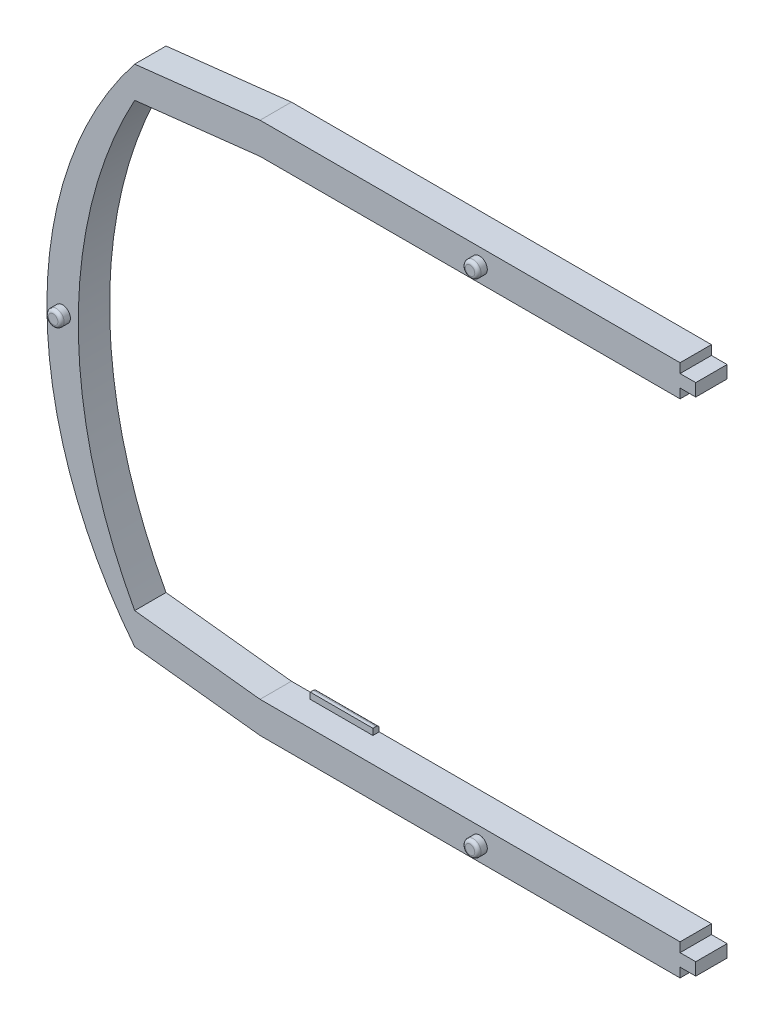
from build123d import *

# Parameters (mm, degrees)
ESQUISSE1_R        = 2.5
BOSS_EXTRU_1_DEPTH = 10
ESQUISSE1_3_R      = 2.5
BOSS_EXTRU_2_DEPTH = 13
CONG_2_R           = 1
CONG_3_R           = 1
ESQUISSE1_4_W      = 20
ESQUISSE1_4_H      = 2
BOSS_EXTRU_3_DEPTH = 2
CONG_4_R           = 1


with BuildPart() as part:
    # Esquisse1 → Boss.-Extru.1 (new body)
    with BuildSketch(Plane.XY):
        with BuildLine():
            Line((-32.758882294, 72.500907441), (-166.758882294, 72.500907441))
            Line((-166.758882294, 72.500907441), (-206.758882294, 68.000907441))
            ThreePointArc((-206.758882294, 68.000907441), (-234.758882294, -12.499092559), (-206.758882294, -92.999092559))
            Line((-206.758882294, -92.999092559), (-166.758882294, -97.499092559))
            Line((-166.758882294, -97.499092559), (-32.758882294, -97.499092559))
            Line((-32.758882294, -97.499092559), (-32.758882294, -94.499092559))
            Line((-32.758882294, -94.499092559), (-27.758882294, -94.499092559))
            Line((-27.758882294, -94.499092559), (-27.758882294, -90.499092559))
            Line((-27.758882294, -90.499092559), (-32.758882294, -90.499092559))
            Line((-32.758882294, -90.499092559), (-32.758882294, -87.499092559))
            Line((-32.758882294, -87.499092559), (-166.758882294, -87.499092559))
            Line((-166.758882294, -87.499092559), (-206.758882294, -82.999092559))
            ThreePointArc((-206.758882294, -82.999092559), (-224.758882294, -12.499092559), (-206.758882294, 58.000907441))
            Line((-206.758882294, 58.000907441), (-166.758882294, 62.500907441))
            Line((-166.758882294, 62.500907441), (-32.758882294, 62.500907441))
            Line((-32.758882294, 62.500907441), (-32.758882294, 65.500907441))
            Line((-32.758882294, 65.500907441), (-27.758882294, 65.500907441))
            Line((-27.758882294, 65.500907441), (-27.758882294, 69.500907441))
            Line((-27.758882294, 69.500907441), (-32.758882294, 69.500907441))
            Line((-32.758882294, 69.500907441), (-32.758882294, 72.500907441))
        make_face()
        with Locations((-96.758882294, 67.500907441)):
            Circle(ESQUISSE1_R, mode=Mode.SUBTRACT)
        with Locations((-229.758882294, -12.499092559)):
            Circle(ESQUISSE1_R, mode=Mode.SUBTRACT)
        with Locations((-96.758882294, -92.499092559)):
            Circle(ESQUISSE1_R, mode=Mode.SUBTRACT)
    extrude(amount=BOSS_EXTRU_1_DEPTH)

    # Esquisse1<3> → Boss.-Extru.2 (add)
    with BuildSketch(Plane.XY):
        with Locations((-229.758882294, -12.499092559)):
            Circle(ESQUISSE1_3_R)
        with Locations((-96.758882294, 67.500907441)):
            Circle(ESQUISSE1_3_R)
        with Locations((-96.758882294, -92.499092559)):
            Circle(ESQUISSE1_3_R)
    extrude(amount=BOSS_EXTRU_2_DEPTH)

    # Congé2
    cong_2_edges = [part.edges().sort_by_distance(p)[0] for p in [
        (-99.258882294, -92.499092559, 13),
    ]]
    fillet(cong_2_edges, radius=CONG_2_R)

    # Congé3
    cong_3_edges = [part.edges().sort_by_distance(p)[0] for p in [
        (-99.258882294, 67.500907441, 13),
        (-232.258882294, -12.499092559, 13),
    ]]
    fillet(cong_3_edges, radius=CONG_3_R)

    # Esquisse1<4> → Boss.-Extru.3 (add)
    with BuildSketch(Plane.XY):
        with Locations((-148.758882294, 61.500907441)):
            Rectangle(ESQUISSE1_4_W, ESQUISSE1_4_H)
        with Locations((-148.758882294, -86.499092559)):
            Rectangle(ESQUISSE1_4_W, ESQUISSE1_4_H)
    extrude(amount=BOSS_EXTRU_3_DEPTH)

    # Congé4
    cong_4_edges = [part.edges().sort_by_distance(p)[0] for p in [
        (-148.758882294, -85.499092559, 0),
        (-148.758882294, 60.500907441, 0),
    ]]
    fillet(cong_4_edges, radius=CONG_4_R)


solid = part.part
